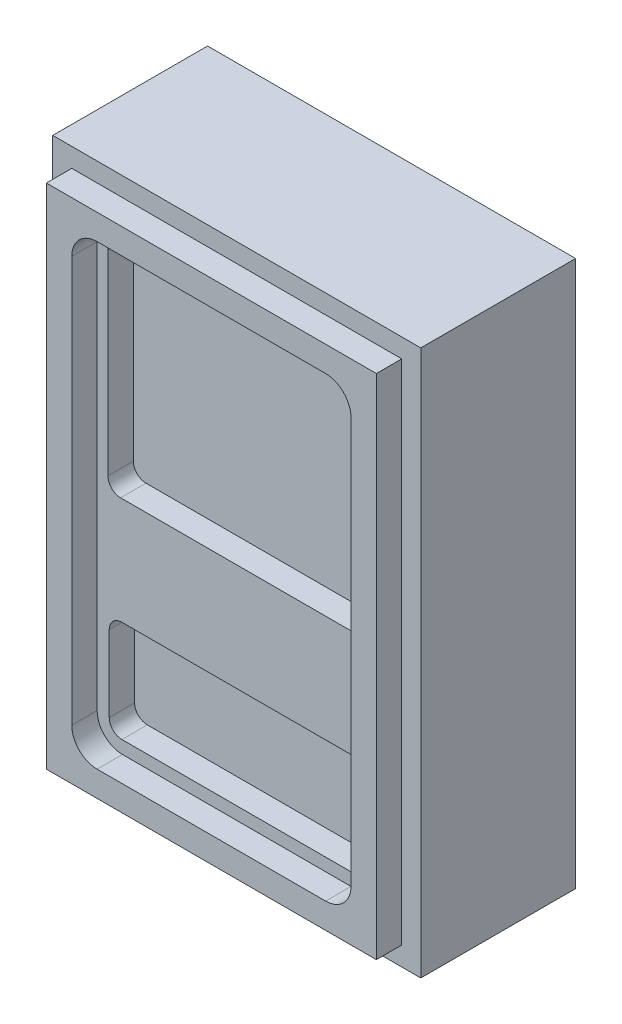
from build123d import *

# Parameters (mm, degrees)
SKETCH1_W           = 2.9
SKETCH1_H           = 4.3
BOSS_EXTRUDE1_DEPTH = 1.22
SKETCH4_W           = 0.6
SKETCH4_H           = 0.4
BOSS_EXTRUDE2_DEPTH = 0.08
SKETCH3_W           = 2.03
SKETCH3_H           = 1.74
SKETCH3_W_2         = 2.01
SKETCH3_H_2         = 0.8
CUT_EXTRUDE2_DEPTH  = 0.2
FILLET1_R           = 0.1
SKETCH2_W           = 2.6
SKETCH2_H           = 4
SKETCH2_W_2         = 2.2
SKETCH2_H_2         = 3.6
BOSS_EXTRUDE3_DEPTH = 0.2
FILLET2_R           = 0.2


with BuildPart() as part:
    # Sketch1 → Boss-Extrude1 (new body)
    with BuildSketch(Plane.XY):
        Rectangle(SKETCH1_W, SKETCH1_H)
    extrude(amount=BOSS_EXTRUDE1_DEPTH)

    # Sketch4 → Boss-Extrude2 (add)
    with BuildSketch(Plane(origin=(0, 0, 0), x_dir=(-1, 0, 0), z_dir=(0, 0, -1))):
        with Locations((0.95, 1.8)):
            Rectangle(SKETCH4_W, SKETCH4_H)
        with Locations((-0.95, 1.8)):
            Rectangle(SKETCH4_W, SKETCH4_H)
        with Locations((0.95, 1.2)):
            Rectangle(SKETCH4_W, SKETCH4_H)
        with Locations((0.95, 0.6)):
            Rectangle(SKETCH4_W, SKETCH4_H)
        with Locations((0.95, 0)):
            Rectangle(SKETCH4_W, SKETCH4_H)
        with Locations((0.95, -0.6)):
            Rectangle(SKETCH4_W, SKETCH4_H)
        with Locations((0.95, -1.2)):
            Rectangle(SKETCH4_W, SKETCH4_H)
        with Locations((0.95, -1.8)):
            Rectangle(SKETCH4_W, SKETCH4_H)
        with Locations((-0.95, 1.2)):
            Rectangle(SKETCH4_W, SKETCH4_H)
        with Locations((-0.95, 0.6)):
            Rectangle(SKETCH4_W, SKETCH4_H)
        with Locations((-0.95, 0)):
            Rectangle(SKETCH4_W, SKETCH4_H)
        with Locations((-0.95, -0.6)):
            Rectangle(SKETCH4_W, SKETCH4_H)
        with Locations((-0.95, -1.2)):
            Rectangle(SKETCH4_W, SKETCH4_H)
        with Locations((-0.95, -1.8)):
            Rectangle(SKETCH4_W, SKETCH4_H)
    extrude(amount=BOSS_EXTRUDE2_DEPTH)

    # Sketch3 → Cut-Extrude2 (cut)
    with BuildSketch(Plane.XY.offset(1.22)):
        with Locations((0, 0.814186616)):
            Rectangle(SKETCH3_W, SKETCH3_H)
        with Locations((0, -1.3)):
            Rectangle(SKETCH3_W_2, SKETCH3_H_2)
    extrude(amount=-CUT_EXTRUDE2_DEPTH, mode=Mode.SUBTRACT)

    # Fillet1
    fillet1_edges = [part.edges().sort_by_distance(p)[0] for p in [
        (1.015, 1.684186616, 1.12),
        (1.015, -0.055813384, 1.12),
        (-1.015, -0.055813384, 1.12),
        (-1.015, 1.684186616, 1.12),
        (1.005, -0.9, 1.12),
        (1.005, -1.7, 1.12),
        (-1.005, -1.7, 1.12),
        (-1.005, -0.9, 1.12),
    ]]
    fillet(fillet1_edges, radius=FILLET1_R)

    # Sketch2 → Boss-Extrude3 (add)
    with BuildSketch(Plane.XY.offset(1.22)):
        Rectangle(SKETCH2_W, SKETCH2_H)
        Rectangle(SKETCH2_W_2, SKETCH2_H_2, mode=Mode.SUBTRACT)
    extrude(amount=BOSS_EXTRUDE3_DEPTH)

    # Fillet2
    fillet2_edges = [part.edges().sort_by_distance(p)[0] for p in [
        (1.1, -1.8, 1.32),
        (-1.1, -1.8, 1.32),
        (-1.1, 1.8, 1.32),
        (1.1, 1.8, 1.32),
    ]]
    fillet(fillet2_edges, radius=FILLET2_R)


solid = part.part
